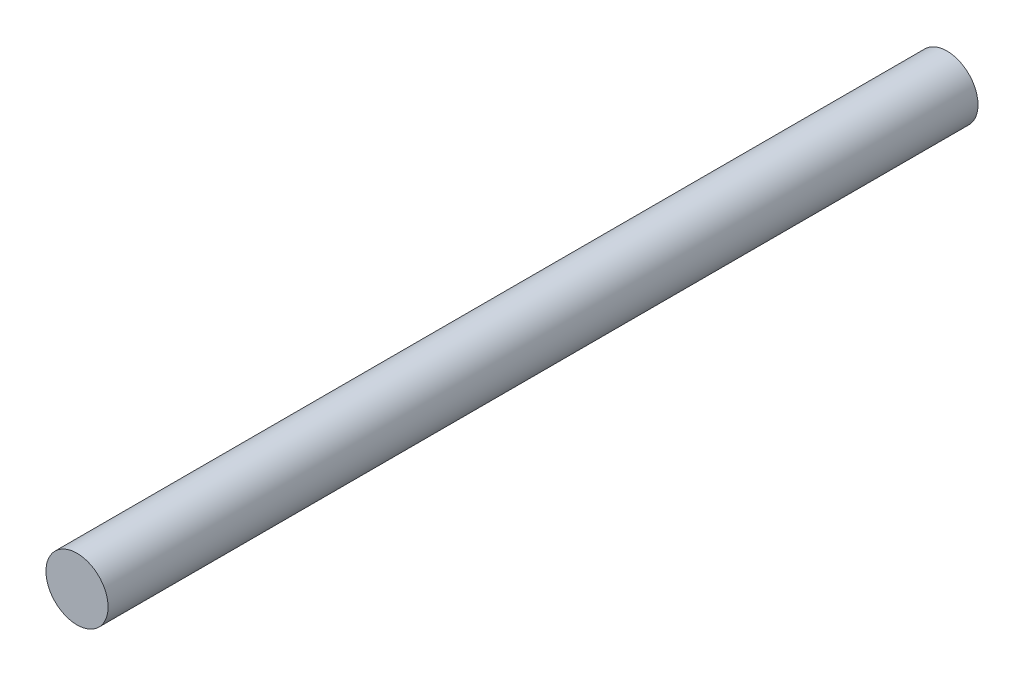
from build123d import *

# Parameters (mm, degrees)
SKETCH_1_R      = 2.5
EXTRUDE_1_DEPTH = 35


with BuildPart() as part:
    # 草图1 → 凸台-拉伸1 (new, symmetric)
    with BuildSketch(Plane.XY):
        Circle(SKETCH_1_R)
    extrude(amount=EXTRUDE_1_DEPTH, both=True)


solid = part.part
